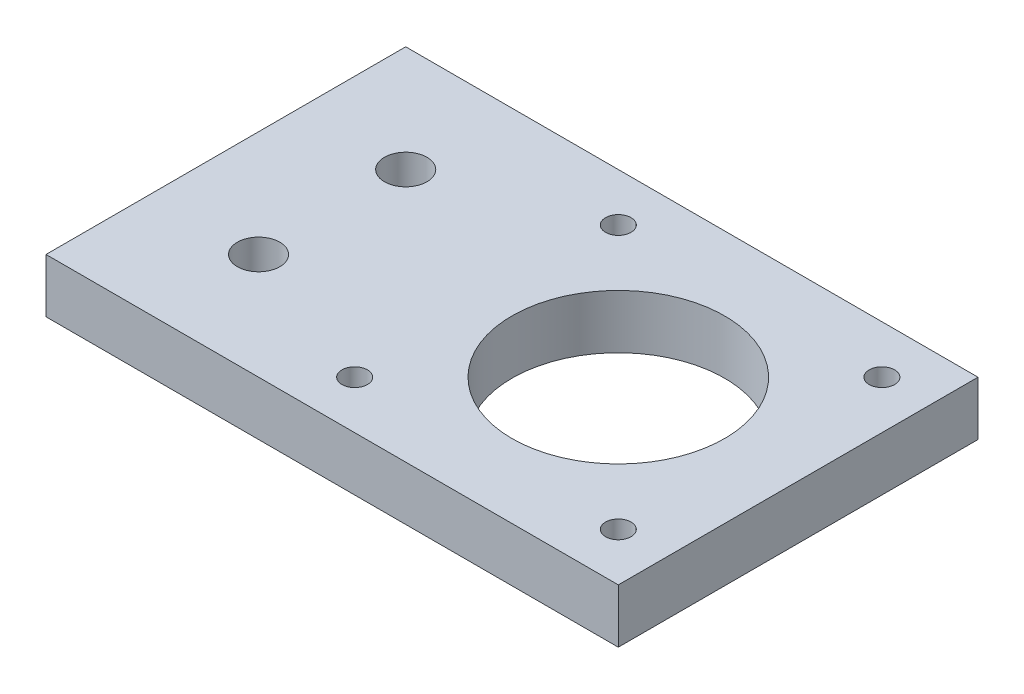
from build123d import *

# Parameters (mm, degrees)
SKETCH1_W           = 67.3
SKETCH1_H           = 42.3
SKETCH1_R           = 1.5
SKETCH1_R_2         = 12.5
SKETCH1_R_3         = 2.5
BOSS_EXTRUDE1_DEPTH = 3.175


with BuildPart() as part:
    # Sketch1 → Boss-Extrude1 (new, symmetric)
    with BuildSketch(Plane(origin=(0, 0, 0), x_dir=(1, 0, 0), z_dir=(0, 1, 0))):
        with Locations((-12.5, 0)):
            Rectangle(SKETCH1_W, SKETCH1_H)
        with Locations(Location((15.5, -15.5, 0), (0, 0, 270))):
            Circle(SKETCH1_R, mode=Mode.SUBTRACT)
        with Locations(Location((15.5, 15.5, 0), (0, 0, 270))):
            Circle(SKETCH1_R, mode=Mode.SUBTRACT)
        with Locations(Location((-15.5, 15.5, 0), (0, 0, 270))):
            Circle(SKETCH1_R, mode=Mode.SUBTRACT)
        with Locations(Location((-15.5, -15.5, 0), (0, 0, 270))):
            Circle(SKETCH1_R, mode=Mode.SUBTRACT)
        with Locations(Location((0, 0, 0), (0, 0, 270))):
            Circle(SKETCH1_R_2, mode=Mode.SUBTRACT)
        with Locations(Location((-33.65, 8.65, 0), (0, 0, 270))):
            Circle(SKETCH1_R_3, mode=Mode.SUBTRACT)
        with Locations(Location((-33.65, -8.65, 0), (0, 0, 270))):
            Circle(SKETCH1_R_3, mode=Mode.SUBTRACT)
    extrude(amount=BOSS_EXTRUDE1_DEPTH, both=True)


solid = part.part
